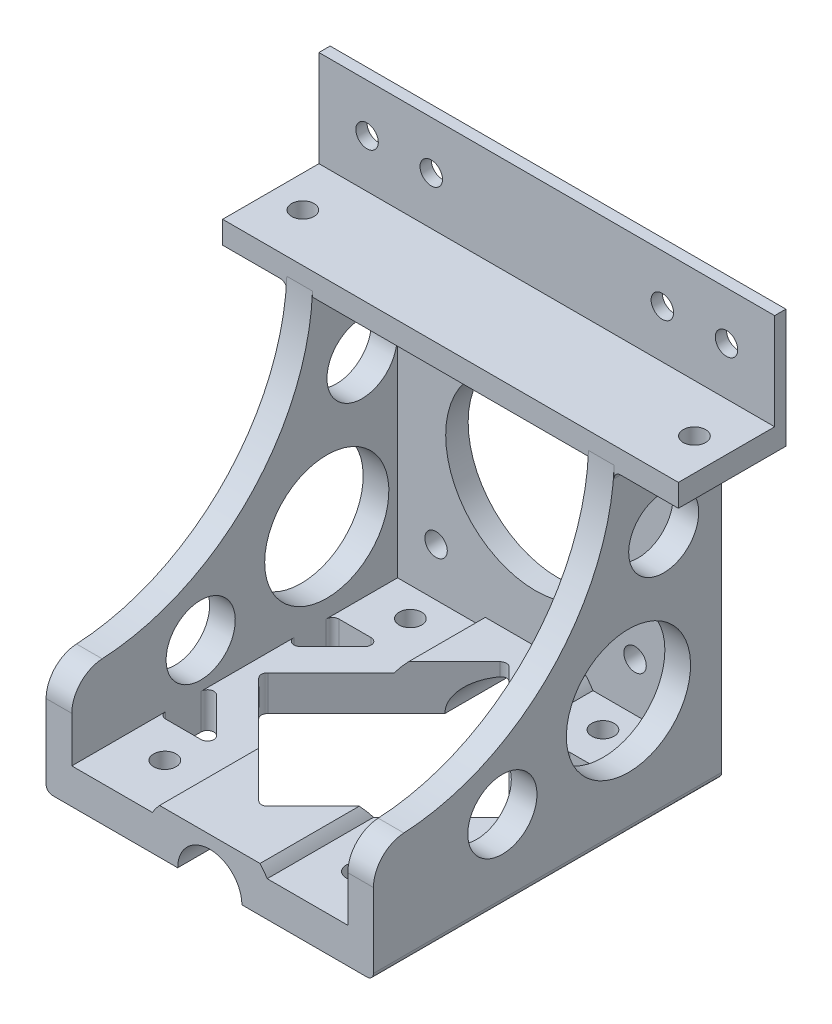
from build123d import *

# Parameters (mm, degrees)
SKETCH1_W                = 51
SKETCH1_H                = 53.5
BOSS_EXTRUDE1_DEPTH      = 54.25
SKETCH2_W                = 43
SKETCH2_H                = 43
CUT_EXTRUDE1_DEPTH       = 50.75
SKETCH3_W                = 43
SKETCH3_H                = 3.5
CUT_EXTRUDE2_DEPTH       = 37.5
CUT_EXTRUDE3_DEPTH       = 76
SKETCH5_R                = 9.673114497
SKETCH5_R_2              = 5.390775308
SKETCH5_R_3              = 5.456912487
CUT_EXTRUDE4_DEPTH       = 76
SKETCH6_R                = 14
SKETCH6_R_2              = 1.75
CUT_EXTRUDE5_DEPTH       = 76
SKETCH7_R                = 5
CUT_EXTRUDE6_DEPTH       = 76
CUT_EXTRUDE7_DEPTH       = 27
FILLET2_R                = 1
SKETCH12_R               = 1.75
CUT_EXTRUDE8_DEPTH       = 15
BOSS_EXTRUDE4_DEPTH      = 10
BOSS_EXTRUDE4_DEPTH_BACK = 61
SKETCH13_W               = 16.75
SKETCH13_H               = 3.5
SKETCH14_W               = 71
SKETCH14_H               = 1.75
BOSS_EXTRUDE5_DEPTH      = 15
SKETCH15_R               = 1.75
CUT_EXTRUDE9_DEPTH       = 10
SKETCH16_R               = 1.75
CUT_EXTRUDE10_DEPTH      = 10
CUT_EXTRUDE11_REACH      = 95.245
FILLET3_R                = 5
FILLET4_R                = 1
CUT_EXTRUDE12_DEPTH      = 3


with BuildPart() as part:
    # Sketch1 → Boss-Extrude1 (new body)
    with BuildSketch(Plane.XY):
        with Locations((-26.432354029, 2.021717979)):
            Rectangle(SKETCH1_W, SKETCH1_H)
    extrude(amount=BOSS_EXTRUDE1_DEPTH)

    # Sketch2 → Cut-Extrude1 (cut)
    with BuildSketch(Plane.XY.offset(54.25)):
        with Locations((-26.432354029, 3.771717979)):
            Rectangle(SKETCH2_W, SKETCH2_H)
    extrude(amount=-CUT_EXTRUDE1_DEPTH, mode=Mode.SUBTRACT)

    # Sketch3 → Cut-Extrude2 (cut)
    with BuildSketch(Plane.XY.offset(54.25)):
        with Locations((-26.432354029, 27.021717979)):
            Rectangle(SKETCH3_W, SKETCH3_H)
    extrude(amount=-CUT_EXTRUDE2_DEPTH, mode=Mode.SUBTRACT)

    # Sketch4 → Cut-Extrude3 (cut)
    with BuildSketch(Plane.ZY.offset(51.932354029)):
        with BuildLine():
            Line((16.75, 28.771717979), (54.25, 28.771717979))
            Line((54.25, 28.771717979), (54.25, -7.074674815))
            ThreePointArc((54.25, -7.074674815), (27.422353926, 2.398250742), (16.75, 28.771717979))
        make_face()
    extrude(amount=-CUT_EXTRUDE3_DEPTH, mode=Mode.SUBTRACT)

    # Sketch5 → Cut-Extrude4 (cut)
    with BuildSketch(Plane.ZY.offset(51.932354029)):
        with Locations(Location((14.525222974, -6.808047023, 0), (0, 0, 270))):
            Circle(SKETCH5_R)
        with Locations(Location((34.168969833, -12.297713654, 0), (0, 0, 270))):
            Circle(SKETCH5_R_2)
        with Locations(Location((9.035556344, 13.166402645, 0), (0, 0, 270))):
            Circle(SKETCH5_R_3)
    extrude(amount=-CUT_EXTRUDE4_DEPTH, mode=Mode.SUBTRACT)

    # Sketch6 → Cut-Extrude5 (cut)
    with BuildSketch(Plane.XY.offset(3.5)):
        with Locations((-26.432354029, 3.771717979)):
            Circle(SKETCH6_R)
        with Locations((-10.932354029, 19.271717979)):
            Circle(SKETCH6_R_2)
        with Locations((-41.932354029, 19.271717979)):
            Circle(SKETCH6_R_2)
        with Locations((-41.932354029, -11.728282021)):
            Circle(SKETCH6_R_2)
        with Locations((-10.932354029, -11.728282021)):
            Circle(SKETCH6_R_2)
    extrude(amount=-CUT_EXTRUDE5_DEPTH, mode=Mode.SUBTRACT)

    # Sketch7 → Cut-Extrude6 (cut)
    with BuildSketch(Plane(origin=(0, 0, 0), x_dir=(-1, 0, 0), z_dir=(0, 0, -1))):
        with Locations((26.432354029, -24.728282021)):
            Circle(SKETCH7_R)
    extrude(amount=-CUT_EXTRUDE6_DEPTH, mode=Mode.SUBTRACT)

    # Sketch8 → Cut-Extrude7 (cut)
    with BuildSketch(Plane.XZ.offset(24.728282021)):
        Polygon((-26.432354029, 46.625), (-6.932354029, 27.125), (-26.432354029, 7.625), (-45.932354029, 27.125), align=None)
        Polygon((-13.361286217, 40.625), (-4.932354029, 40.625), (-4.932354029, 32.196067812), align=None)
        Polygon((-4.932354029, 13.625), (-13.361286217, 13.625), (-4.932354029, 22.053932188), align=None)
        Polygon((-47.932354029, 13.625), (-39.503421841, 13.625), (-47.932354029, 22.053932188), align=None)
        Polygon((-47.932354029, 40.625), (-39.007101497, 40.625), (-47.932354029, 31.699747468), align=None)
    extrude(amount=-CUT_EXTRUDE7_DEPTH, mode=Mode.SUBTRACT)

    # Fillet2
    fillet2_edges = [part.edges().sort_by_distance(p)[0] for p in [
        (-47.932354029, -21.228282021, 31.699747468),
        (-4.932354029, -21.228282021, 32.196067812),
        (-4.932354029, -21.228282021, 22.053932188),
        (-47.932354029, -21.228282021, 22.053932188),
        (-13.361286217, -21.228282021, 13.625),
        (-39.503421841, -21.228282021, 13.625),
        (-26.432354029, -18.728282021, 7.625),
        (-4.932354029, -21.228282021, 13.625),
        (-47.932354029, -21.228282021, 13.625),
        (-45.932354029, -21.228282021, 27.125),
        (-6.932354029, -21.228282021, 27.125),
        (-4.932354029, -21.228282021, 40.625),
        (-47.932354029, -21.228282021, 40.625),
        (-39.007101497, -21.228282021, 40.625),
        (-13.361286217, -21.228282021, 40.625),
        (-26.432354029, -18.728282021, 46.625),
    ]]
    fillet(fillet2_edges, radius=FILLET2_R)

    # Sketch12 → Cut-Extrude8 (cut)
    with BuildSketch(Plane.XZ.offset(24.728282021)):
        with Locations(Location((-11.432354029, 46.25, 0), (0, 0, 270))):
            Circle(SKETCH12_R)
        with Locations(Location((-41.432354029, 46.25, 0), (0, 0, 270))):
            Circle(SKETCH12_R)
        with Locations(Location((-11.432354029, 8, 0), (0, 0, 270))):
            Circle(SKETCH12_R)
        with Locations(Location((-41.432354029, 8, 0), (0, 0, 270))):
            Circle(SKETCH12_R)
    extrude(amount=-CUT_EXTRUDE8_DEPTH, mode=Mode.SUBTRACT)

    # Sketch13 → Boss-Extrude4 (add, two sides: drawn at the far end of the back side and taken through both)
    with BuildSketch(Plane.ZY.offset(51.932354029).offset(-BOSS_EXTRUDE4_DEPTH_BACK)):
        with Locations((8.375, 27.021717979)):
            Rectangle(SKETCH13_W, SKETCH13_H)
    extrude(amount=BOSS_EXTRUDE4_DEPTH + BOSS_EXTRUDE4_DEPTH_BACK)

    # Sketch14 → Boss-Extrude5 (add)
    with BuildSketch(Plane(origin=(0, 28.771717979, 0), x_dir=(1, 0, 0), z_dir=(0, 1, 0))):
        with Locations((-26.432354029, -0.875)):
            Rectangle(SKETCH14_W, SKETCH14_H)
    extrude(amount=BOSS_EXTRUDE5_DEPTH)

    # Sketch15 → Cut-Extrude9 (cut)
    with BuildSketch(Plane.XZ.offset(-25.271717979)):
        with Locations((-56.932354029, 9.25)):
            Circle(SKETCH15_R)
        with Locations((4.067645971, 9.25)):
            Circle(SKETCH15_R)
    extrude(amount=-CUT_EXTRUDE9_DEPTH, mode=Mode.SUBTRACT)

    # Sketch16 → Cut-Extrude10 (cut)
    with BuildSketch(Plane(origin=(0, 0, 0), x_dir=(-1, 0, 0), z_dir=(0, 0, -1))):
        with Locations((54.432354029, 36.271717979)):
            Circle(SKETCH16_R)
        with Locations((-1.567645971, 36.271717979)):
            Circle(SKETCH16_R)
        with Locations((44.432354029, 36.271717979)):
            Circle(SKETCH16_R)
        with Locations((8.432354029, 36.271717979)):
            Circle(SKETCH16_R)
    extrude(amount=-CUT_EXTRUDE10_DEPTH, mode=Mode.SUBTRACT)

    # Cut-Extrude11: up to this face of the body (flat: up to its plane)
    cut_extrude11_end = Plane(part.part.faces().sort_by_distance((-26.432354029, -17.120170189, 3.5))[0])
    # Sketch17 → Cut-Extrude11 (cut, up to the picked face)
    with BuildSketch(Plane.XY.offset(54.25), mode=Mode.PRIVATE) as cut_extrude11_sk1:
        with BuildLine():
            Line((-17.488082119, -19.228282021), (-4.932354029, -19.228282021))
            Line((-4.932354029, -19.228282021), (-4.932354029, -17.728282021))
            Line((-4.932354029, -17.728282021), (-18.606116108, -17.728282021))
            ThreePointArc((-18.606116108, -17.728282021), (-18.013624909, -18.453331822), (-17.488082119, -19.228282021))
        make_face()
    cut_extrude11_tool1 = split(extrude(cut_extrude11_sk1.sketch, amount=-CUT_EXTRUDE11_REACH, mode=Mode.PRIVATE), bisect_by=cut_extrude11_end, keep=Keep.BOTH, mode=Mode.PRIVATE)
    # Sketch17 → Cut-Extrude11 (cut, up to the picked face)
    with BuildSketch(Plane.XY.offset(54.25), mode=Mode.PRIVATE) as cut_extrude11_sk2:
        with BuildLine():
            Line((-35.376625939, -19.228282021), (-47.932354029, -19.228282021))
            Line((-47.932354029, -19.228282021), (-47.932354029, -17.728282021))
            Line((-47.932354029, -17.728282021), (-34.25859195, -17.728282021))
            ThreePointArc((-34.25859195, -17.728282021), (-34.851083149, -18.453331822), (-35.376625939, -19.228282021))
        make_face()
    cut_extrude11_tool2 = split(extrude(cut_extrude11_sk2.sketch, amount=-CUT_EXTRUDE11_REACH, mode=Mode.PRIVATE), bisect_by=cut_extrude11_end, keep=Keep.BOTH, mode=Mode.PRIVATE)
    add(cut_extrude11_tool1.solids().sort_by(Axis((-11.476334, -18.467624, 54.25), (0, 0, -1)))[0], mode=Mode.SUBTRACT)
    add(cut_extrude11_tool2.solids().sort_by(Axis((-41.388374, -18.467624, 54.25), (0, 0, -1)))[0], mode=Mode.SUBTRACT)

    # Fillet3
    fillet3_edges = [part.edges().sort_by_distance(p)[0] for p in [
        (-2.932354029, -7.074674815, 54.25),
        (-49.932354029, -7.074674815, 54.25),
    ]]
    fillet(fillet3_edges, radius=FILLET3_R)

    # Fillet4
    fillet4_edges = [part.edges().sort_by_distance(p)[0] for p in [
        (-51.932354029, 25.271717979, 8.375),
        (-0.932354029, 25.271717979, 8.375),
        (-0.932354029, -24.728282021, 27.125),
        (-51.932354029, -24.728282021, 27.125),
    ]]
    fillet(fillet4_edges, radius=FILLET4_R)

    # Sketch19 → Cut-Extrude12 (cut)
    with BuildSketch(Plane(origin=(0, -24.728282021, 0), x_dir=(1, 0, 0), z_dir=(0, 1, 0))):
        Polygon((-44.432354029, -9.732050808), (-41.432354029, -11.464101615), (-38.432354029, -9.732050808), (-38.432354029, -6.267949192), (-41.432354029, -4.535898385), (-44.432354029, -6.267949192), align=None)
        Polygon((-11.432354029, -4.535898385), (-14.432354029, -6.267949192), (-14.432354029, -9.732050808), (-11.432354029, -11.464101615), (-8.432354029, -9.732050808), (-8.432354029, -6.267949192), align=None)
        Polygon((-38.432354029, -47.982050808), (-38.432354029, -44.517949192), (-41.432354029, -42.785898385), (-44.432354029, -44.517949192), (-44.432354029, -47.982050808), (-41.432354029, -49.714101615), align=None)
        Polygon((-8.432354029, -47.982050808), (-8.432354029, -44.517949192), (-11.432354029, -42.785898385), (-14.432354029, -44.517949192), (-14.432354029, -47.982050808), (-11.432354029, -49.714101615), align=None)
    extrude(amount=CUT_EXTRUDE12_DEPTH, mode=Mode.SUBTRACT)


solid = part.part
